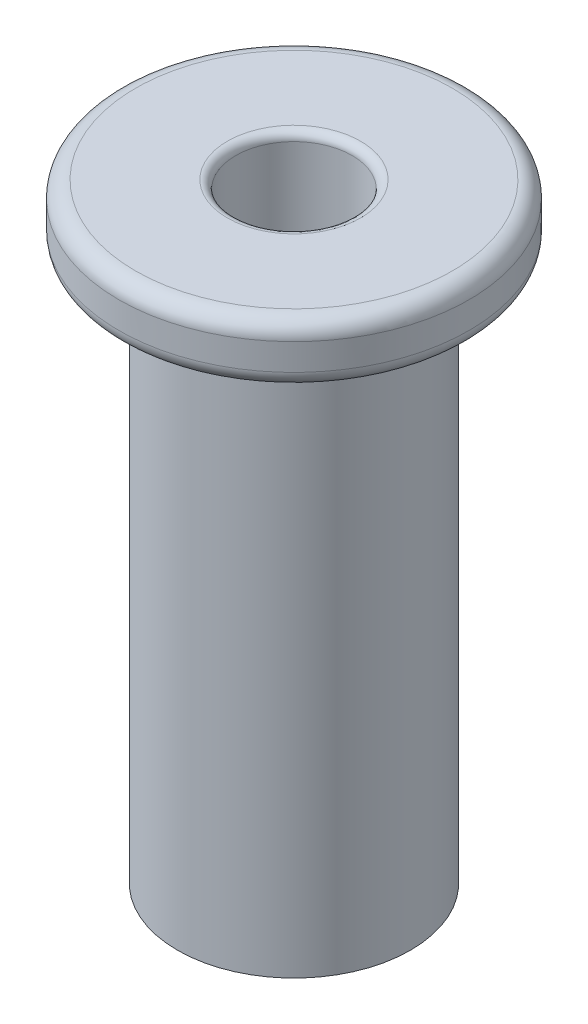
from build123d import *

# Parameters (mm, degrees)
SKETCH1_R           = 5.2575
BOSS_EXTRUDE2_DEPTH = 18.3
SKETCH3_R           = 1.75
CUT_EXTRUDE2_DEPTH  = 19.8
SKETCH4_R           = 5.2575
SKETCH4_R_2         = 3.5
CUT_EXTRUDE3_DEPTH  = 16.5
FILLET1_R           = 0.5
FILLET2_R           = 0.25
FILLET3_R           = 0.5


with BuildPart() as part:
    # Sketch1 → Boss-Extrude2 (new body)
    with BuildSketch(Plane(origin=(0, 0, 0), x_dir=(1, 0, 0), z_dir=(0, 1, 0))):
        with Locations(Location((0, 0, 0), (0, 0, 270))):
            Circle(SKETCH1_R)
    extrude(amount=BOSS_EXTRUDE2_DEPTH)

    # Sketch3 → Cut-Extrude2 (cut)
    with BuildSketch(Plane(origin=(0, 0, 0), x_dir=(-1, 0, 0), z_dir=(0, -1, 0))):
        with Locations(Location((0, 0, 0), (0, 0, 90))):
            Circle(SKETCH3_R)
    extrude(amount=-CUT_EXTRUDE2_DEPTH, mode=Mode.SUBTRACT)

    # Sketch4 → Cut-Extrude3 (cut)
    with BuildSketch(Plane(origin=(0, 0, 0), x_dir=(-1, 0, 0), z_dir=(0, -1, 0))):
        with Locations(Location((0, 0, 0), (0, 0, 90))):
            Circle(SKETCH4_R)
        with Locations(Location((0, 0, 0), (0, 0, 90))):
            Circle(SKETCH4_R_2, mode=Mode.SUBTRACT)
    extrude(amount=-CUT_EXTRUDE3_DEPTH, mode=Mode.SUBTRACT)

    # Fillet1
    fillet1_edges = [part.edges().sort_by_distance(p)[0] for p in [
        (0, 18.3, -5.2575),
    ]]
    fillet(fillet1_edges, radius=FILLET1_R)

    # Fillet2
    fillet2_edges = [part.edges().sort_by_distance(p)[0] for p in [
        (0, 18.3, 1.75),
    ]]
    fillet(fillet2_edges, radius=FILLET2_R)

    # Fillet3
    fillet3_edges = [part.edges().sort_by_distance(p)[0] for p in [
        (0, 16.5, -5.2575),
    ]]
    fillet(fillet3_edges, radius=FILLET3_R)


solid = part.part
